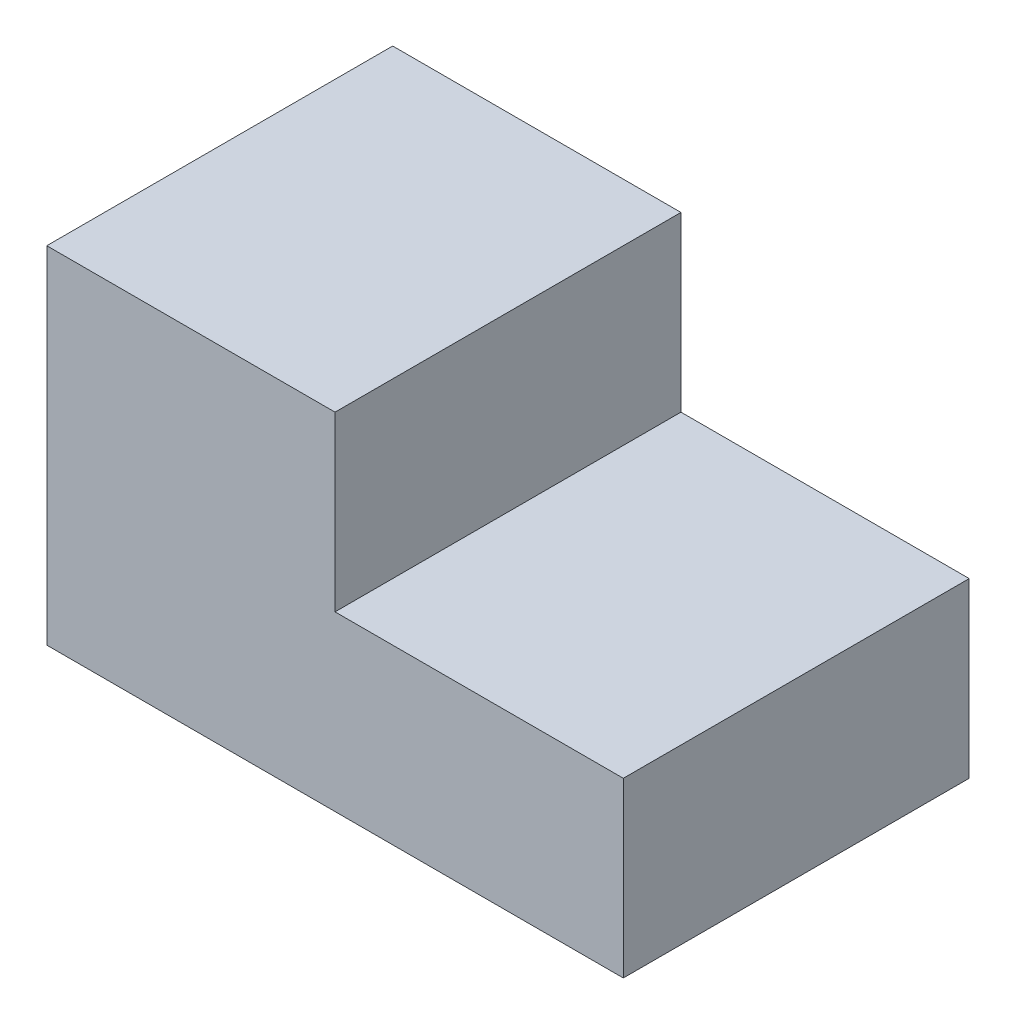
from build123d import *

# Parameters (mm, degrees)
RESSALTO_EXTRUS_O1_DEPTH = 60


with BuildPart() as part:
    # Esboço2 → Ressalto-extrusão1 (new body)
    with BuildSketch(Plane.XY):
        Polygon((0, 0), (-100, 0), (-100, 60), (-50, 60), (-50, 30), (0, 30), align=None)
    extrude(amount=RESSALTO_EXTRUS_O1_DEPTH)


solid = part.part
